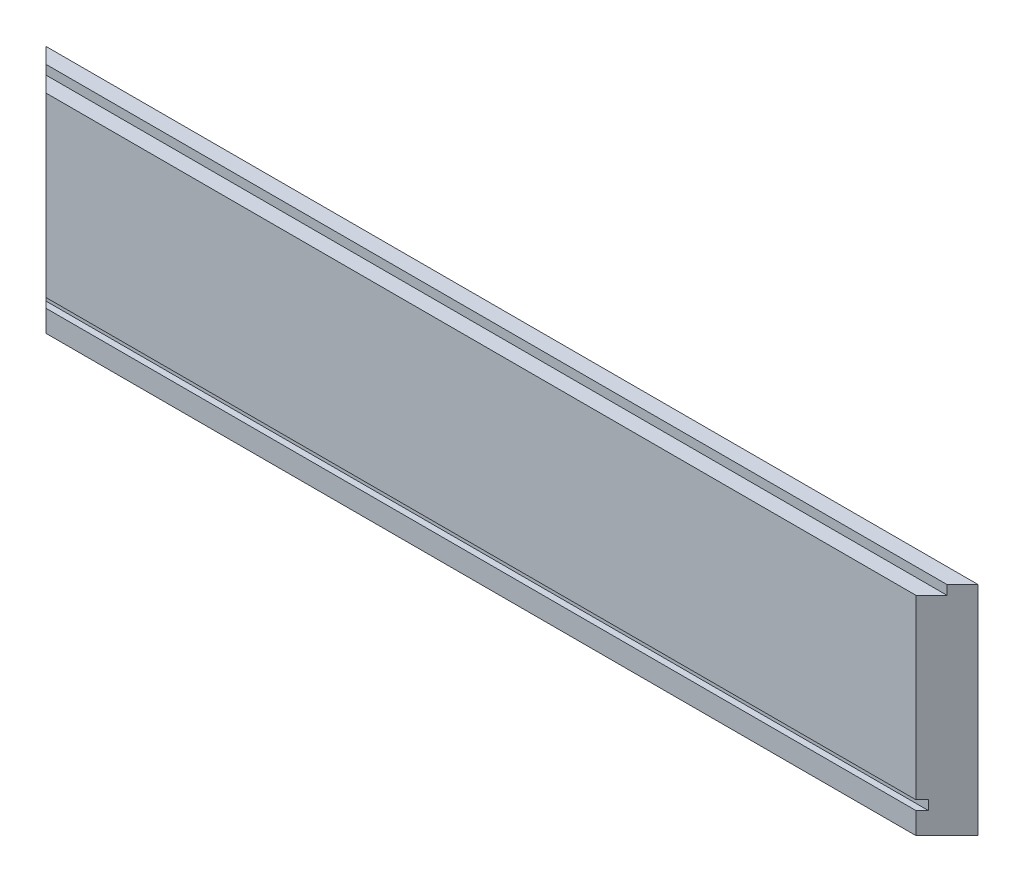
from build123d import *

# Parameters (mm, degrees)
BOSS_EXTRUDE1_DEPTH     = 70
CUT_EXTRUDE1_DEPTH      = 309.220700148
CUT_EXTRUDE1_DEPTH_BACK = 3
SKETCH3_W               = 300
SKETCH3_H               = 3
CUT_EXTRUDE2_DEPTH      = 2


with BuildPart() as part:
    # Sketch1 → Boss-Extrude1 (new body)
    with BuildSketch(Plane(origin=(0, 0, 0), x_dir=(1, 0, 0), z_dir=(0, 1, 0))):
        Polygon((0, 10), (10, 0), (290, 0), (300, 10), align=None)
    extrude(amount=BOSS_EXTRUDE1_DEPTH)

    # Sketch2 → Cut-Extrude1 (cut, two sides: drawn at the far end of the back side and taken through both)
    with BuildSketch(Plane(origin=(0, 70, 0), x_dir=(1, 0, 0), z_dir=(0, 1, 0)).offset(-CUT_EXTRUDE1_DEPTH_BACK)):
        Polygon((295, 5), (5, 5), (10, 0), (290, 0), align=None)
    extrude(amount=CUT_EXTRUDE1_DEPTH + CUT_EXTRUDE1_DEPTH_BACK, mode=Mode.SUBTRACT)

    # Sketch3 → Cut-Extrude2 (cut)
    with BuildSketch(Plane.XY):
        with Locations((150, 8.5)):
            Rectangle(SKETCH3_W, SKETCH3_H)
    extrude(amount=-CUT_EXTRUDE2_DEPTH, mode=Mode.SUBTRACT)


solid = part.part
